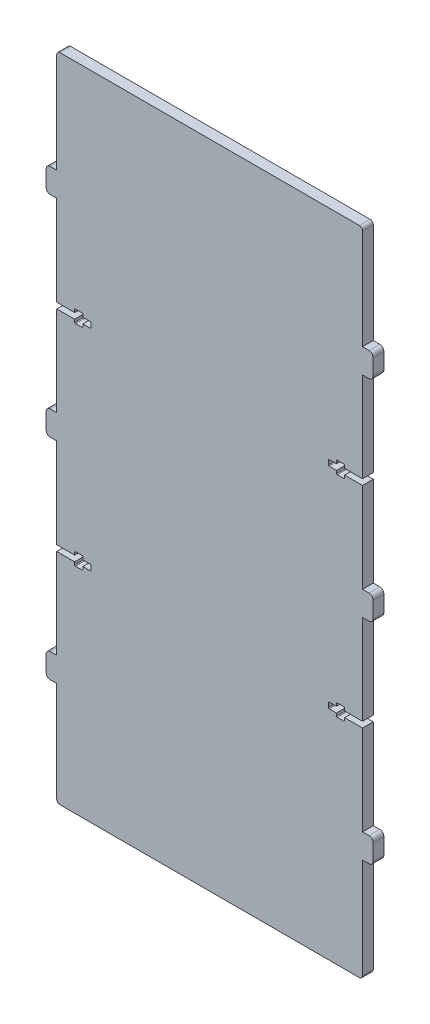
from build123d import *

# Parameters (mm, degrees)
BOSS_EXTRUDE1_DEPTH = 6.6


with BuildPart() as part:
    # Model → Boss-Extrude1 (new body)
    with BuildSketch(Plane.XY):
        with BuildLine():
            Line((-6.5, 76), (-6.5, 66))
            ThreePointArc((-6.5, 66), (-5.767766953, 64.232233047), (-4, 63.5))
            Line((-4, 63.5), (0, 63.5))
            Line((0, 63.5), (0, 2))
            ThreePointArc((0, 2), (0.585786438, 0.585786438), (2, 0))
            Line((2, 0), (185.8, 0))
            ThreePointArc((185.8, 0), (187.214213562, 0.585786438), (187.8, 2))
            Line((187.8, 2), (187.8, 63.5))
            Line((187.8, 63.5), (191.8, 63.5))
            ThreePointArc((191.8, 63.5), (193.567766953, 64.232233047), (194.3, 66))
            Line((194.3, 66), (194.3, 76))
            ThreePointArc((194.3, 76), (193.567766953, 77.767766953), (191.8, 78.5))
            Line((191.8, 78.5), (187.8, 78.5))
            Line((187.8, 78.5), (187.8, 133.7375))
            Line((187.8, 133.7375), (176.8, 133.7375))
            Line((176.8, 133.7375), (176.8, 132.1525))
            ThreePointArc((176.8, 132.1525), (176.653553391, 131.798946609), (176.3, 131.6525))
            Line((176.3, 131.6525), (172.3, 131.6525))
            ThreePointArc((172.3, 131.6525), (171.946446609, 131.798946609), (171.8, 132.1525))
            Line((171.8, 132.1525), (171.8, 133.7375))
            Line((171.8, 133.7375), (167.3, 133.7375))
            ThreePointArc((167.3, 133.7375), (166.946446609, 133.883946609), (166.8, 134.2375))
            Line((166.8, 134.2375), (166.8, 136.7875))
            ThreePointArc((166.8, 136.7875), (166.946446609, 137.141053391), (167.3, 137.2875))
            Line((167.3, 137.2875), (171.8, 137.2875))
            Line((171.8, 137.2875), (171.8, 138.8725))
            ThreePointArc((171.8, 138.8725), (171.946446609, 139.226053391), (172.3, 139.3725))
            Line((172.3, 139.3725), (176.3, 139.3725))
            ThreePointArc((176.3, 139.3725), (176.653553391, 139.226053391), (176.8, 138.8725))
            Line((176.8, 138.8725), (176.8, 137.2875))
            Line((176.8, 137.2875), (187.8, 137.2875))
            Line((187.8, 137.2875), (187.8, 192.525))
            Line((187.8, 192.525), (191.8, 192.525))
            ThreePointArc((191.8, 192.525), (193.567766953, 193.257233047), (194.3, 195.025))
            Line((194.3, 195.025), (194.3, 205.025))
            ThreePointArc((194.3, 205.025), (193.567766953, 206.792766953), (191.8, 207.525))
            Line((191.8, 207.525), (187.8, 207.525))
            Line((187.8, 207.525), (187.8, 262.7625))
            Line((187.8, 262.7625), (176.8, 262.7625))
            Line((176.8, 262.7625), (176.8, 261.1775))
            ThreePointArc((176.8, 261.1775), (176.653553391, 260.823946609), (176.3, 260.6775))
            Line((176.3, 260.6775), (172.3, 260.6775))
            ThreePointArc((172.3, 260.6775), (171.946446609, 260.823946609), (171.8, 261.1775))
            Line((171.8, 261.1775), (171.8, 262.7625))
            Line((171.8, 262.7625), (167.3, 262.7625))
            ThreePointArc((167.3, 262.7625), (166.946446609, 262.908946609), (166.8, 263.2625))
            Line((166.8, 263.2625), (166.8, 265.8125))
            ThreePointArc((166.8, 265.8125), (166.946446609, 266.166053391), (167.3, 266.3125))
            Line((167.3, 266.3125), (171.8, 266.3125))
            Line((171.8, 266.3125), (171.8, 267.8975))
            ThreePointArc((171.8, 267.8975), (171.946446609, 268.251053391), (172.3, 268.3975))
            Line((172.3, 268.3975), (176.3, 268.3975))
            ThreePointArc((176.3, 268.3975), (176.653553391, 268.251053391), (176.8, 267.8975))
            Line((176.8, 267.8975), (176.8, 266.3125))
            Line((176.8, 266.3125), (187.8, 266.3125))
            Line((187.8, 266.3125), (187.8, 321.55))
            Line((187.8, 321.55), (191.8, 321.55))
            ThreePointArc((191.8, 321.55), (193.567766953, 322.282233047), (194.3, 324.05))
            Line((194.3, 324.05), (194.3, 334.05))
            ThreePointArc((194.3, 334.05), (193.567766953, 335.817766953), (191.8, 336.55))
            Line((191.8, 336.55), (187.8, 336.55))
            Line((187.8, 336.55), (187.8, 398.05))
            ThreePointArc((187.8, 398.05), (187.214213562, 399.464213562), (185.8, 400.05))
            Line((185.8, 400.05), (2, 400.05))
            ThreePointArc((2, 400.05), (0.585786438, 399.464213562), (0, 398.05))
            Line((0, 398.05), (0, 336.55))
            Line((0, 336.55), (-4, 336.55))
            ThreePointArc((-4, 336.55), (-5.767766953, 335.817766953), (-6.5, 334.05))
            Line((-6.5, 334.05), (-6.5, 324.05))
            ThreePointArc((-6.5, 324.05), (-5.767766953, 322.282233047), (-4, 321.55))
            Line((-4, 321.55), (0, 321.55))
            Line((0, 321.55), (0, 266.3125))
            Line((0, 266.3125), (11, 266.3125))
            Line((11, 266.3125), (11, 267.8975))
            ThreePointArc((11, 267.8975), (11.146446609, 268.251053391), (11.5, 268.3975))
            Line((11.5, 268.3975), (15.5, 268.3975))
            ThreePointArc((15.5, 268.3975), (15.853553391, 268.251053391), (16, 267.8975))
            Line((16, 267.8975), (16, 266.3125))
            Line((16, 266.3125), (20.5, 266.3125))
            ThreePointArc((20.5, 266.3125), (20.853553391, 266.166053391), (21, 265.8125))
            Line((21, 265.8125), (21, 263.2625))
            ThreePointArc((21, 263.2625), (20.853553391, 262.908946609), (20.5, 262.7625))
            Line((20.5, 262.7625), (16, 262.7625))
            Line((16, 262.7625), (16, 261.1775))
            ThreePointArc((16, 261.1775), (15.853553391, 260.823946609), (15.5, 260.6775))
            Line((15.5, 260.6775), (11.5, 260.6775))
            ThreePointArc((11.5, 260.6775), (11.146446609, 260.823946609), (11, 261.1775))
            Line((11, 261.1775), (11, 262.7625))
            Line((11, 262.7625), (0, 262.7625))
            Line((0, 262.7625), (0, 207.525))
            Line((0, 207.525), (-4, 207.525))
            ThreePointArc((-4, 207.525), (-5.767766953, 206.792766953), (-6.5, 205.025))
            Line((-6.5, 205.025), (-6.5, 195.025))
            ThreePointArc((-6.5, 195.025), (-5.767766953, 193.257233047), (-4, 192.525))
            Line((-4, 192.525), (0, 192.525))
            Line((0, 192.525), (0, 137.2875))
            Line((0, 137.2875), (11, 137.2875))
            Line((11, 137.2875), (11, 138.8725))
            ThreePointArc((11, 138.8725), (11.146446609, 139.226053391), (11.5, 139.3725))
            Line((11.5, 139.3725), (15.5, 139.3725))
            ThreePointArc((15.5, 139.3725), (15.853553391, 139.226053391), (16, 138.8725))
            Line((16, 138.8725), (16, 137.2875))
            Line((16, 137.2875), (20.5, 137.2875))
            ThreePointArc((20.5, 137.2875), (20.853553391, 137.141053391), (21, 136.7875))
            Line((21, 136.7875), (21, 134.2375))
            ThreePointArc((21, 134.2375), (20.853553391, 133.883946609), (20.5, 133.7375))
            Line((20.5, 133.7375), (16, 133.7375))
            Line((16, 133.7375), (16, 132.1525))
            ThreePointArc((16, 132.1525), (15.853553391, 131.798946609), (15.5, 131.6525))
            Line((15.5, 131.6525), (11.5, 131.6525))
            ThreePointArc((11.5, 131.6525), (11.146446609, 131.798946609), (11, 132.1525))
            Line((11, 132.1525), (11, 133.7375))
            Line((11, 133.7375), (0, 133.7375))
            Line((0, 133.7375), (0, 78.5))
            Line((0, 78.5), (-4, 78.5))
            ThreePointArc((-4, 78.5), (-5.767766953, 77.767766953), (-6.5, 76))
        make_face()
    extrude(amount=BOSS_EXTRUDE1_DEPTH)


solid = part.part
